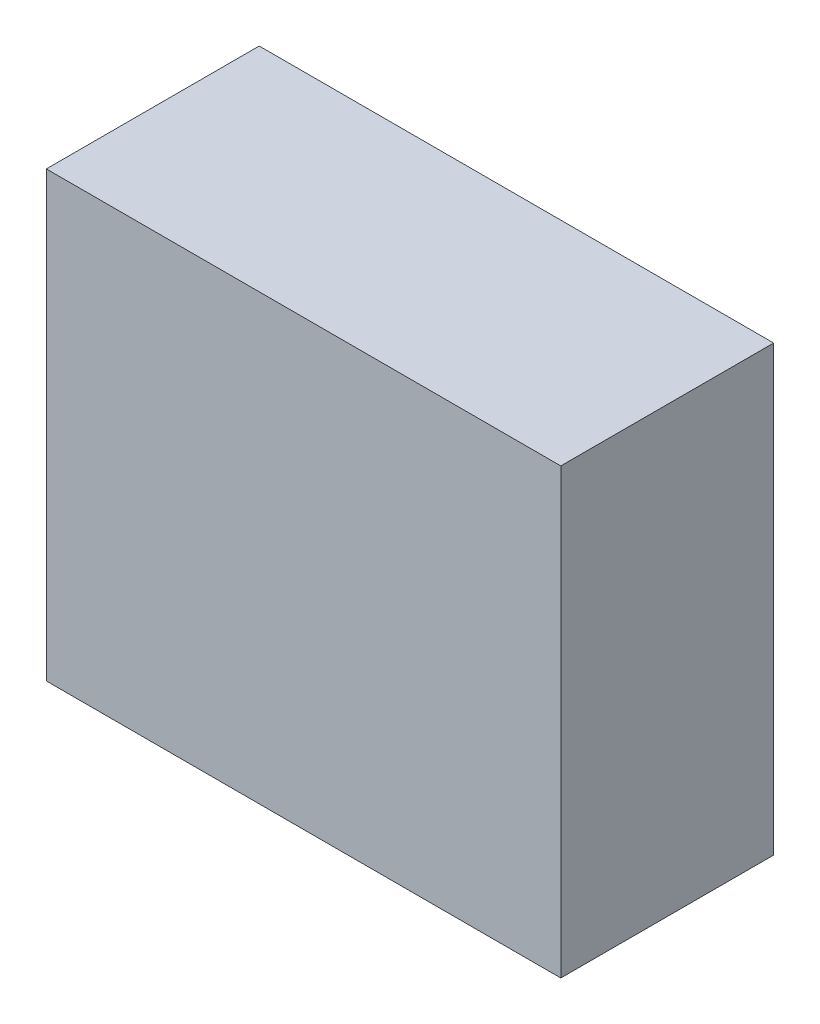
from build123d import *

# Parameters (mm, degrees)
SKETCH1_W           = 29
SKETCH1_H           = 12
BOSS_EXTRUDE1_DEPTH = 25


with BuildPart() as part:
    # Sketch1 → Boss-Extrude1 (new body)
    with BuildSketch(Plane(origin=(0, 0, 0), x_dir=(1, 0, 0), z_dir=(0, 1, 0))):
        with Locations((14.5, 6)):
            Rectangle(SKETCH1_W, SKETCH1_H)
    extrude(amount=BOSS_EXTRUDE1_DEPTH)


solid = part.part
